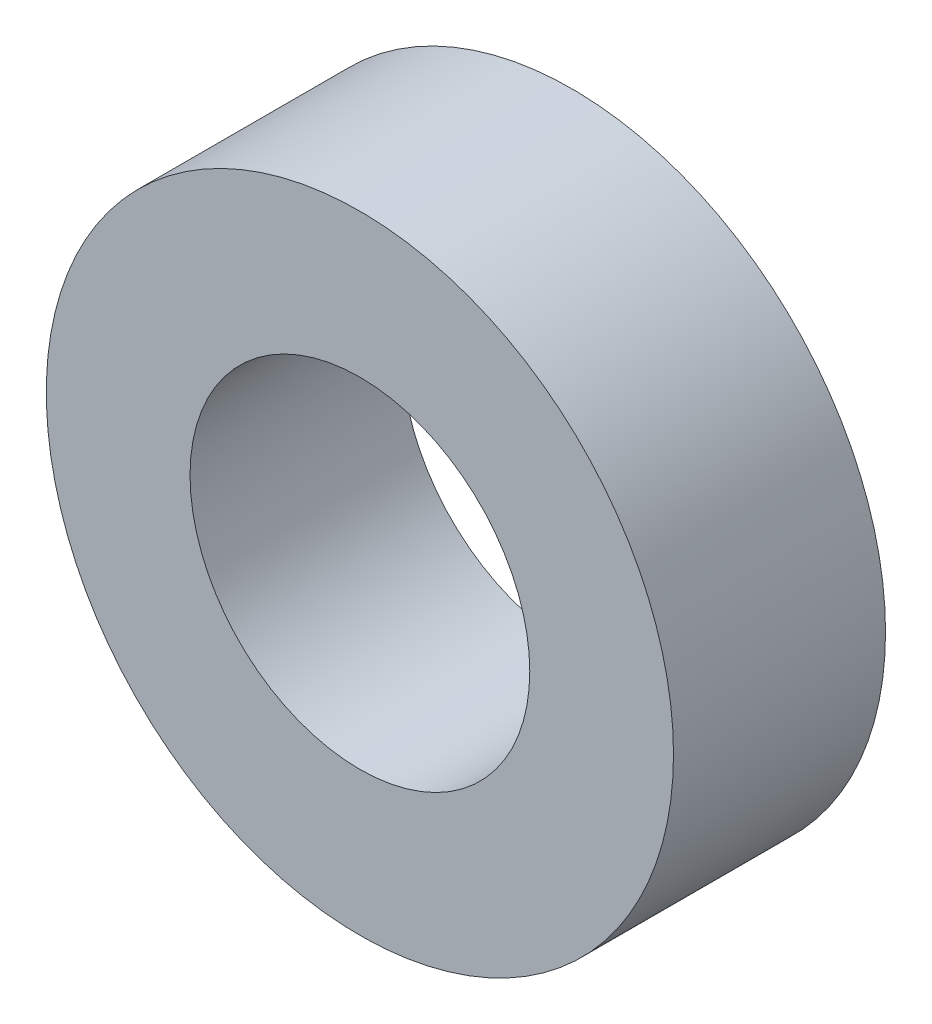
from build123d import *

# Parameters (mm, degrees)
SKETCH1_R           = 6
SKETCH1_R_2         = 3.25
BOSS_EXTRUDE1_DEPTH = 2.02825


with BuildPart() as part:
    # Sketch1 → Boss-Extrude1 (new, symmetric)
    with BuildSketch(Plane.XY):
        Circle(SKETCH1_R)
        Circle(SKETCH1_R_2, mode=Mode.SUBTRACT)
    extrude(amount=BOSS_EXTRUDE1_DEPTH, both=True)


solid = part.part
